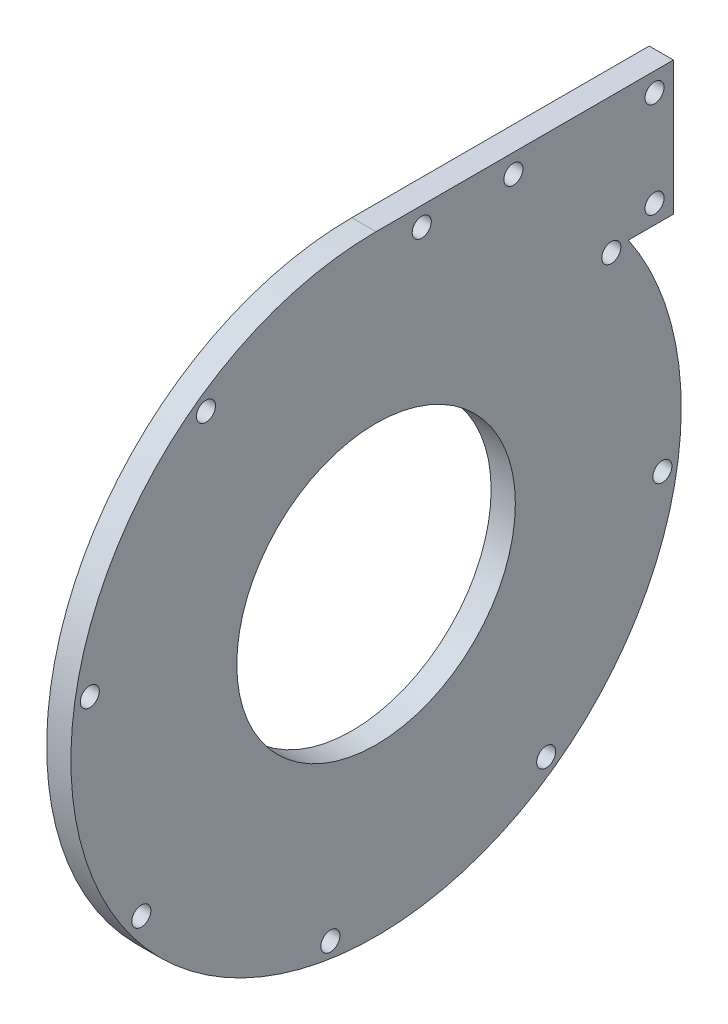
from build123d import *

# Parameters (mm, degrees)
SKETCH1_R           = 36.5125
BOSS_EXTRUDE1_DEPTH = 6.35
SKETCH3_R           = 2.5
CUT_EXTRUDE1_DEPTH  = 114.315146825
CIRPATTERN1_COUNT   = 8
SKETCH4_R           = 2.5
CUT_EXTRUDE4_DEPTH  = 114.315146825


with BuildPart() as part:
    # Sketch1 → Boss-Extrude1 (new body)
    with BuildSketch(Plane(origin=(0, 0, 0), x_dir=(0, 0, -1), z_dir=(1, 0, 0))):
        with BuildLine():
            Line((77.95, 80), (0, 80))
            ThreePointArc((0, 80), (-37.416573868, -70.710678119), (66.143782777, 45))
            Line((66.143782777, 45), (77.95, 45))
            Line((77.95, 45), (77.95, 80))
        make_face()
        Circle(SKETCH1_R, mode=Mode.SUBTRACT)
    extrude(amount=BOSS_EXTRUDE1_DEPTH)

    # Sketch3 → Cut-Extrude1 (cut, through all)
    with BuildSketch(Plane(origin=(6.35, 0, 0), x_dir=(0, 0, -1), z_dir=(1, 0, 0))):
        with Locations((11.979044202, 75.05)):
            Circle(SKETCH3_R)
    cut_extrude1 = extrude(amount=-CUT_EXTRUDE1_DEPTH, mode=Mode.SUBTRACT)

    # CirPattern1: Cut-Extrude1 ×8 about axis, 1 skipped
    cirpattern1_axis = Axis((0, 0, 0), (1, 0, 0))
    add([cut_extrude1.rotate(cirpattern1_axis, i * 360 / CIRPATTERN1_COUNT) for i in range(1, CIRPATTERN1_COUNT) if i not in (7,)], mode=Mode.SUBTRACT)

    # Sketch4 → Cut-Extrude4 (cut, through all)
    with BuildSketch(Plane(origin=(6.35, 0, 0), x_dir=(0, 0, -1), z_dir=(1, 0, 0))):
        with Locations((36, 75.05)):
            Circle(SKETCH4_R)
        with Locations((73, 75.05)):
            Circle(SKETCH4_R)
        with Locations((73, 49.95)):
            Circle(SKETCH4_R)
        with Locations((61.665635624, 44.422397314)):
            Circle(SKETCH4_R)
    extrude(amount=-CUT_EXTRUDE4_DEPTH, mode=Mode.SUBTRACT)


solid = part.part
